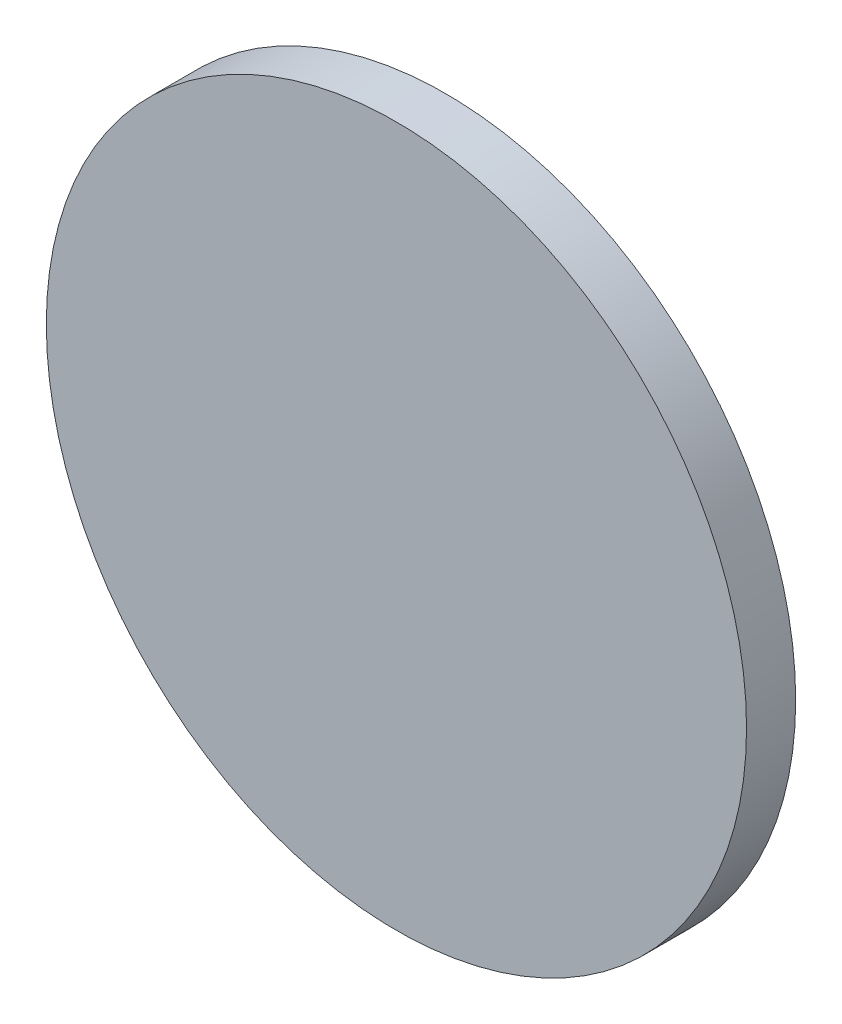
from build123d import *

# Parameters (mm, degrees)
CROQUIS1_R              = 28.5
SALIENTE_EXTRUIR1_DEPTH = 4


with BuildPart() as part:
    # Croquis1 → Saliente-Extruir1 (new body)
    with BuildSketch(Plane.XY):
        Circle(CROQUIS1_R)
    extrude(amount=SALIENTE_EXTRUIR1_DEPTH)


solid = part.part
